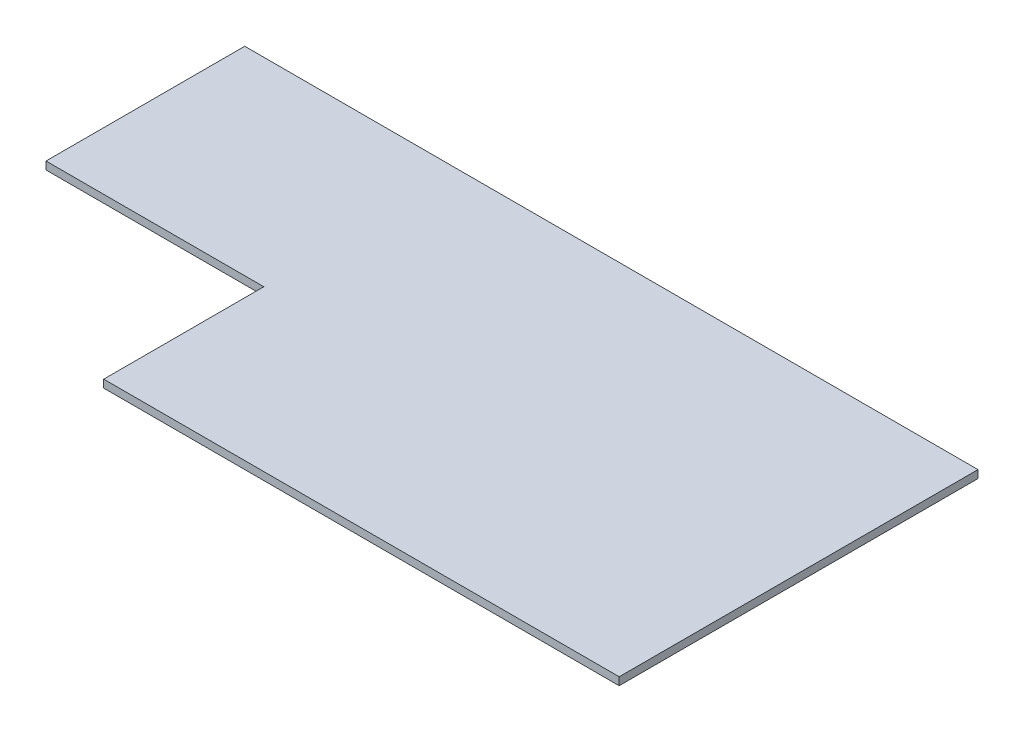
from build123d import *

# Parameters (mm, degrees)
BOSS_EXTRUDE1_DEPTH = 3.175


with BuildPart() as part:
    # Sketch1 → Boss-Extrude1 (new, symmetric)
    with BuildSketch(Plane(origin=(0, 0, 0), x_dir=(1, 0, 0), z_dir=(0, 1, 0))):
        Polygon((-123.586938376, -144.861370582), (296.021061624, -144.861370582), (296.021061624, 147.238629418), (-300.878938376, 147.238629418), (-300.878938376, -14.559370582), (-123.586938376, -14.559370582), align=None)
    extrude(amount=BOSS_EXTRUDE1_DEPTH, both=True)


solid = part.part
